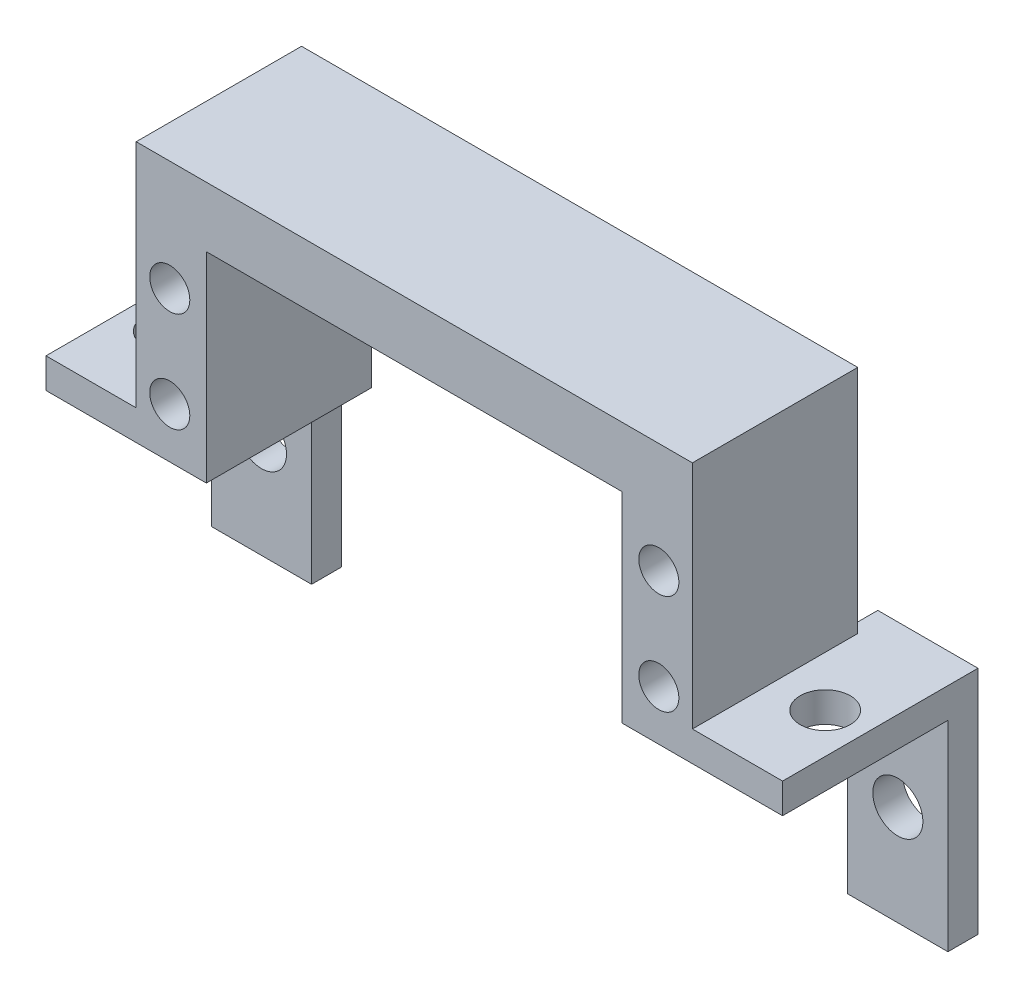
from build123d import *

# Parameters (mm, degrees)
EXTRUDE_1_DEPTH     = 16.5
SKETCH_2_R          = 2.5
CUT_EXTRUDE_1_DEPTH = 16.5
SKETCH_3_W          = 10
SKETCH_3_H          = 16.5
CUT_EXTRUDE_2_DEPTH = 3
SKETCH_5_R          = 2
CUT_EXTRUDE_4_DEPTH = 48.945933091
SKETCH_6_W          = 10
SKETCH_6_H          = 23
EXTRUDE_2_DEPTH     = 3
SKETCH_7_R          = 2.5
CUT_EXTRUDE_5_DEPTH = 3
SKETCH2_W           = 16.5
SKETCH2_H           = 23
BOSS_EXTRUDE1_DEPTH = 1
SKETCH3_W           = 16.5
SKETCH3_H           = 23
BOSS_EXTRUDE2_DEPTH = 1


with BuildPart() as part:
    # 草图1 → 凸台-拉伸1 (new body)
    with BuildSketch(Plane.XY):
        Polygon((0, 0), (26.75, 0), (26.75, -20), (36.75, -20), (36.75, -26), (20.75, -26), (20.75, -6), (0, -6), (-20.75, -6), (-20.75, -26), (-36.75, -26), (-36.75, -20), (-26.75, -20), (-26.75, 0), align=None)
    extrude(amount=EXTRUDE_1_DEPTH)

    # 草图2 → 切除-拉伸1 (cut)
    with BuildSketch(Plane(origin=(0, -20, 0), x_dir=(1, 0, 0), z_dir=(0, 1, 0))):
        with Locations(Location((32.75, -8.25, 0), (0, 0, 270))):
            Circle(SKETCH_2_R)
        with Locations(Location((-32.75, -8.25, 0), (0, 0, 270))):
            Circle(SKETCH_2_R)
    extrude(amount=-CUT_EXTRUDE_1_DEPTH, mode=Mode.SUBTRACT)

    # 草图3 → 切除-拉伸2 (cut)
    with BuildSketch(Plane(origin=(0, -20, 0), x_dir=(1, 0, 0), z_dir=(0, 1, 0))):
        with Locations((31.75, -8.25)):
            Rectangle(SKETCH_3_W, SKETCH_3_H)
        with Locations((-31.75, -8.25)):
            Rectangle(SKETCH_3_W, SKETCH_3_H)
    extrude(amount=-CUT_EXTRUDE_2_DEPTH, mode=Mode.SUBTRACT)

    # 草图5 → 切除-拉伸4 (cut, through all)
    with BuildSketch(Plane(origin=(0, 0, 0), x_dir=(-1, 0, 0), z_dir=(0, 0, -1))):
        with Locations((-24.4, -11)):
            Circle(SKETCH_5_R)
        with Locations((-24.4, -21)):
            Circle(SKETCH_5_R)
        with Locations(Location((24.4, -21, 0), (0, 0, 180))):
            Circle(SKETCH_5_R)
        with Locations(Location((24.4, -11, 0), (0, 0, 180))):
            Circle(SKETCH_5_R)
    extrude(amount=-CUT_EXTRUDE_4_DEPTH, mode=Mode.SUBTRACT)

    # 草图6 → 凸台-拉伸2 (add)
    with BuildSketch(Plane(origin=(0, 0, 0), x_dir=(-1, 0, 0), z_dir=(0, 0, -1))):
        with Locations((-31.75, -34.5)):
            Rectangle(SKETCH_6_W, SKETCH_6_H)
        with Locations((31.75, -34.5)):
            Rectangle(SKETCH_6_W, SKETCH_6_H)
    extrude(amount=EXTRUDE_2_DEPTH)

    # 草图7 → 切除-拉伸5 (cut)
    with BuildSketch(Plane(origin=(0, 0, -3), x_dir=(-1, 0, 0), z_dir=(0, 0, -1))):
        with Locations((-31.75, -36)):
            Circle(SKETCH_7_R)
        with Locations((31.75, -36)):
            Circle(SKETCH_7_R)
    extrude(amount=-CUT_EXTRUDE_5_DEPTH, mode=Mode.SUBTRACT)

    # Sketch2 → Boss-Extrude1 (add)
    with BuildSketch(Plane.ZY.offset(26.75)):
        with Locations((8.25, -11.5)):
            Rectangle(SKETCH2_W, SKETCH2_H)
    extrude(amount=BOSS_EXTRUDE1_DEPTH)

    # Sketch3 → Boss-Extrude2 (add)
    with BuildSketch(Plane(origin=(26.75, 0, 0), x_dir=(0, 0, -1), z_dir=(1, 0, 0))):
        with Locations((-8.25, -11.5)):
            Rectangle(SKETCH3_W, SKETCH3_H)
    extrude(amount=BOSS_EXTRUDE2_DEPTH)


solid = part.part
